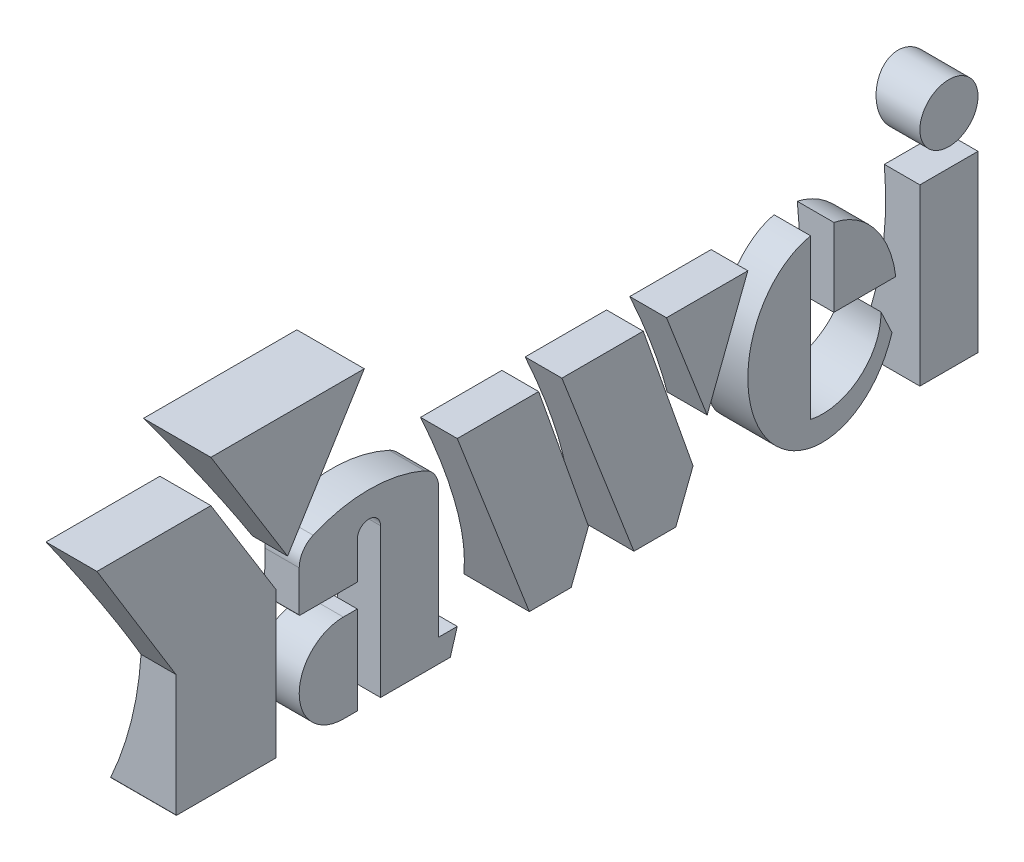
from build123d import *

# Parameters (mm, degrees)
EXTRUDE_1_DEPTH     = 20
EXTRUDE_1_2_DEPTH   = 20
EXTRUDE_1_3_DEPTH   = 20
SKETCH_2_W          = 12.5
SKETCH_2_H          = 37.5
EXTRUDE_1_4_DEPTH   = 20
EXTRUDE_1_5_DEPTH   = 20
EXTRUDE_1_6_DEPTH   = 20
EXTRUDE_1_7_DEPTH   = 20
EXTRUDE_1_8_DEPTH   = 20
EXTRUDE_1_9_DEPTH   = 20
SKETCH_2_R          = 6.25
EXTRUDE_1_10_DEPTH  = 20
EXTRUDE_2_DEPTH     = 20
SKETCH_4_R          = 75
CUT_EXTRUDE_2_DEPTH = 524.350910285


with BuildPart() as part:
    # 草图2 → 凸台-拉伸1 (new body)
    with BuildSketch(Plane(origin=(0, 0, 0), x_dir=(0, 0, -1), z_dir=(1, 0, 0))):
        with BuildLine():
            Line((5.929490869, 424.427866758), (7.429490869, 429.427866758))
            Line((7.429490869, 429.427866758), (3.429490869, 429.427866758))
            Line((3.429490869, 429.427866758), (3.429490869, 457.340745232))
            ThreePointArc((3.429490869, 457.340745232), (2.612791001, 460.07935802), (0.429490869, 461.923320927))
            ThreePointArc((0.429490869, 461.923320927), (-11.570509131, 464.427866758), (-23.570509131, 461.923320927))
            ThreePointArc((-23.570509131, 461.923320927), (-25.753809264, 460.07935802), (-26.570509131, 457.340745232))
            Line((-26.570509131, 457.340745232), (-26.570509131, 448.577866758))
            ThreePointArc((-26.570509131, 448.577866758), (-26.526575148, 448.47180074), (-26.420509131, 448.427866758))
            Line((-26.420509131, 448.427866758), (-14.070509131, 448.427866758))
            Line((-14.070509131, 448.427866758), (-14.070509131, 456.427866758))
            ThreePointArc((-14.070509131, 456.427866758), (-11.570509131, 458.927866758), (-9.070509131, 456.427866758))
            Line((-9.070509131, 456.427866758), (-9.070509131, 424.427866758))
            Line((-9.070509131, 424.427866758), (5.929490869, 424.427866758))
        make_face()
    extrude(amount=EXTRUDE_1_DEPTH)


with BuildPart() as body_2:
    # 草图2 → Extrude 1 2 (new body)
    with BuildSketch(Plane(origin=(0, 0, 0), x_dir=(0, 0, -1), z_dir=(1, 0, 0))):
        with BuildLine():
            Line((-70.070509131, 478.427866758), (-53.070509131, 450.715053837))
            Line((-53.070509131, 450.715053837), (-53.070509131, 424.577866758))
            ThreePointArc((-53.070509131, 424.577866758), (-53.026575148, 424.47180074), (-52.920509131, 424.427866758))
            Line((-52.920509131, 424.427866758), (-31.570509131, 424.427866758))
            Line((-31.570509131, 424.427866758), (-31.570509131, 455.807548639))
            Line((-31.570509131, 455.807548639), (-45.570509131, 478.427866758))
            Line((-45.570509131, 478.427866758), (-70.070509131, 478.427866758))
        make_face()
    extrude(amount=EXTRUDE_1_2_DEPTH)


with BuildPart() as body_3:
    # 草图2 → Extrude 1 3 (new body)
    with BuildSketch(Plane(origin=(0, 0, 0), x_dir=(0, 0, -1), z_dir=(1, 0, 0))):
        with BuildLine():
            Line((-14.070509131, 424.427866758), (-14.070509131, 443.427866758))
            Line((-14.070509131, 443.427866758), (-17.070509131, 443.427866758))
            ThreePointArc((-17.070509131, 443.427866758), (-26.570509131, 433.927866758), (-17.070509131, 424.427866758))
            Line((-17.070509131, 424.427866758), (-14.070509131, 424.427866758))
        make_face()
    extrude(amount=EXTRUDE_1_3_DEPTH)


with BuildPart() as body_4:
    # 草图2 → Extrude 1 4 (new body)
    with BuildSketch(Plane(origin=(0, 0, 0), x_dir=(0, 0, -1), z_dir=(1, 0, 0))):
        with Locations((113.179490869, 443.177866758)):
            Rectangle(SKETCH_2_W, SKETCH_2_H)
    extrude(amount=EXTRUDE_1_4_DEPTH)


with BuildPart() as body_5:
    # 草图2 → Extrude 1 5 (new body)
    with BuildSketch(Plane(origin=(0, 0, 0), x_dir=(0, 0, -1), z_dir=(1, 0, 0))):
        Polygon((54.429490869, 424.427866758), (58.142941161, 433.976738938), (47.429490869, 464.427866758), (29.929490869, 464.427866758), (45.429490869, 424.427866758), align=None)
    extrude(amount=EXTRUDE_1_5_DEPTH)


with BuildPart() as body_6:
    # 草图2 → Extrude 1 6 (new body)
    with BuildSketch(Plane(origin=(0, 0, 0), x_dir=(0, 0, -1), z_dir=(1, 0, 0))):
        Polygon((31.929490869, 424.427866758), (35.642941161, 433.976738938), (24.929490869, 464.427866758), (7.429490869, 464.427866758), (22.929490869, 424.427866758), align=None)
    extrude(amount=EXTRUDE_1_6_DEPTH)


with BuildPart() as body_7:
    # 草图2 → Extrude 1 7 (new body)
    with BuildSketch(Plane(origin=(0, 0, 0), x_dir=(0, 0, -1), z_dir=(1, 0, 0))):
        Polygon((69.929490869, 464.427866758), (52.429490869, 464.427866758), (61.179490869, 441.927866758), align=None)
    extrude(amount=EXTRUDE_1_7_DEPTH)


with BuildPart() as body_8:
    # 草图2 → Extrude 1 8 (new body)
    with BuildSketch(Plane(origin=(0, 0, 0), x_dir=(0, 0, -1), z_dir=(1, 0, 0))):
        with BuildLine():
            add(Edge.make_bspline(
                [(101.748466815, 447.427866758), (99.992454165, 461.895742739), (88.429490869, 464.182217544)],
                knots=[4.862957253, 4.862957253, 4.862957253, 6.126292436, 6.126292436, 6.126292436], degree=2, weights=[1, 0.807043932, 1]))
            Line((88.429490869, 464.182217544), (88.429490869, 447.427866758))
            Line((88.429490869, 447.427866758), (101.748466815, 447.427866758))
        make_face()
    extrude(amount=EXTRUDE_1_8_DEPTH)


with BuildPart() as body_9:
    # 草图2 → Extrude 1 9 (new body)
    with BuildSketch(Plane(origin=(0, 0, 0), x_dir=(0, 0, -1), z_dir=(1, 0, 0))):
        with BuildLine():
            Line((83.429490869, 429.969357426), (83.429490869, 464.182217544))
            add(Edge.make_bspline(
                [(83.429490869, 464.182217544), (55.912124292, 458.740899105), (73.539383857, 431.773492006), (91.166643422, 404.806084906), (100.917486065, 437.427866758)],
                knots=[0.156892871, 0.156892871, 0.156892871, 2.255855374, 2.255855374, 4.354817877, 4.354817877, 4.354817877], degree=2, weights=[1, 0.498020955, 1, 0.498020955, 1]))
            Line((100.917486065, 437.427866758), (98.570833336, 442.429980403))
            ThreePointArc((98.570833336, 442.429980403), (93.988389037, 432.568568972), (83.429490869, 429.969357426))
        make_face()
    extrude(amount=EXTRUDE_1_9_DEPTH)


with BuildPart() as body_10:
    # 草图2 → Extrude 1 10 (new body)
    with BuildSketch(Plane(origin=(0, 0, 0), x_dir=(0, 0, -1), z_dir=(1, 0, 0))):
        with Locations((113.179490869, 472.177866758)):
            Circle(SKETCH_2_R)
    extrude(amount=EXTRUDE_1_10_DEPTH)


with BuildPart() as body_11:
    # 草图2<3> → 凸台-拉伸2 (new body)
    with BuildSketch(Plane(origin=(0, 0, 0), x_dir=(0, 0, -1), z_dir=(1, 0, 0))):
        Polygon((-12.570509131, 487.427866758), (-45.570509131, 487.427866758), (-29.070509131, 460.768206118), align=None)
    extrude(amount=EXTRUDE_2_DEPTH)


with BuildPart() as cut_extrude_2_tool:
    # 草图4 → 切除-拉伸2 (new, through all)
    with BuildSketch(Plane(origin=(0, 0, -119.429490869), x_dir=(-1, 0, 0), z_dir=(0, 0, -1))):
        with Locations((62.364974001, 455.487511946)):
            Circle(SKETCH_4_R)
    extrude(amount=-CUT_EXTRUDE_2_DEPTH)


with BuildPart() as part_1:
    add(part.part)

    # 切除-拉伸2: cut by cut_extrude_2_tool
    add(cut_extrude_2_tool.part, mode=Mode.SUBTRACT)


with BuildPart() as body_2_1:
    add(body_2.part)

    # 切除-拉伸2: cut by cut_extrude_2_tool
    add(cut_extrude_2_tool.part, mode=Mode.SUBTRACT)


with BuildPart() as body_3_1:
    add(body_3.part)

    # 切除-拉伸2: cut by cut_extrude_2_tool
    add(cut_extrude_2_tool.part, mode=Mode.SUBTRACT)


with BuildPart() as body_4_1:
    add(body_4.part)

    # 切除-拉伸2: cut by cut_extrude_2_tool
    add(cut_extrude_2_tool.part, mode=Mode.SUBTRACT)


with BuildPart() as body_5_1:
    add(body_5.part)

    # 切除-拉伸2: cut by cut_extrude_2_tool
    add(cut_extrude_2_tool.part, mode=Mode.SUBTRACT)


with BuildPart() as body_6_1:
    add(body_6.part)

    # 切除-拉伸2: cut by cut_extrude_2_tool
    add(cut_extrude_2_tool.part, mode=Mode.SUBTRACT)


with BuildPart() as body_7_1:
    add(body_7.part)

    # 切除-拉伸2: cut by cut_extrude_2_tool
    add(cut_extrude_2_tool.part, mode=Mode.SUBTRACT)


with BuildPart() as body_8_1:
    add(body_8.part)

    # 切除-拉伸2: cut by cut_extrude_2_tool
    add(cut_extrude_2_tool.part, mode=Mode.SUBTRACT)


with BuildPart() as body_9_1:
    add(body_9.part)

    # 切除-拉伸2: cut by cut_extrude_2_tool
    add(cut_extrude_2_tool.part, mode=Mode.SUBTRACT)


with BuildPart() as body_10_1:
    add(body_10.part)

    # 切除-拉伸2: cut by cut_extrude_2_tool
    add(cut_extrude_2_tool.part, mode=Mode.SUBTRACT)


with BuildPart() as body_11_1:
    add(body_11.part)

    # 切除-拉伸2: cut by cut_extrude_2_tool
    add(cut_extrude_2_tool.part, mode=Mode.SUBTRACT)


solid = Compound([part_1.part, body_2_1.part, body_3_1.part, body_4_1.part, body_5_1.part, body_6_1.part, body_7_1.part, body_8_1.part, body_9_1.part, body_10_1.part, body_11_1.part])
